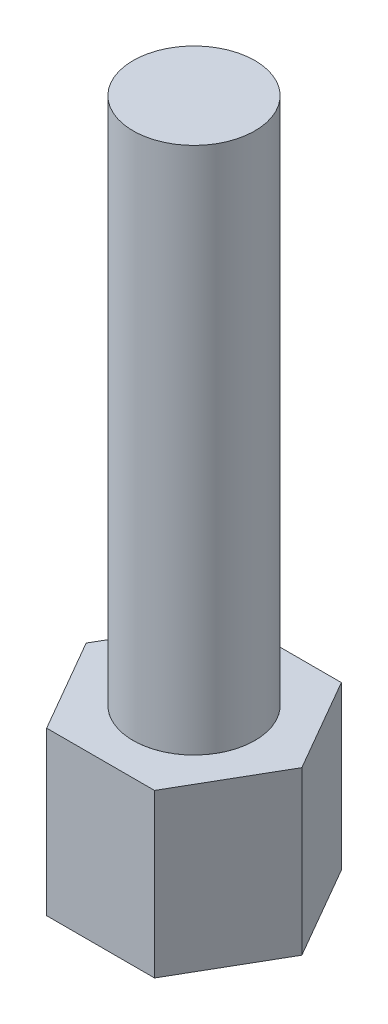
from build123d import *

# Parameters (mm, degrees)
EXTRUDE_1_DEPTH     = 4
SKETCH_3_R          = 1.5
EXTRUDE_2_DEPTH     = 13
SKETCH_4_R          = 1.5
CUT_EXTRUDE_1_DEPTH = 4


with BuildPart() as part:
    # 草图1 → 凸台-拉伸1 (new body)
    with BuildSketch(Plane(origin=(0, 0, 0), x_dir=(1, 0, 0), z_dir=(0, 1, 0))):
        Polygon((-1.327905619, 2.3), (-2.655811238, 0), (-1.327905619, -2.3), (1.327905619, -2.3), (2.655811238, 0), (1.327905619, 2.3), align=None)
    extrude(amount=EXTRUDE_1_DEPTH)

    # 草图3 → 凸台-拉伸2 (add)
    with BuildSketch(Plane(origin=(0, 4, 0), x_dir=(1, 0, 0), z_dir=(0, 1, 0))):
        with Locations(Location((0, 0, 0), (0, 0, 90))):
            Circle(SKETCH_3_R)
    extrude(amount=EXTRUDE_2_DEPTH)

    # 草图4 → 切除-拉伸1 (cut)
    with BuildSketch(Plane.XZ):
        with Locations(Location((0, 0, 0), (0, 0, 270))):
            Circle(SKETCH_4_R)
    extrude(amount=-CUT_EXTRUDE_1_DEPTH, mode=Mode.SUBTRACT)


with BuildPart() as cut_extrude_1_piece_1:
    # of the separate pieces the step leaves, piece 1, a body of its own (cut_extrude_1_pieces)
    add(part.part.solids().sort_by_distance((0, 17, -1.5))[0])


with BuildPart() as cut_extrude_1_piece_2:
    # of the separate pieces the step leaves, piece 2, a body of its own (cut_extrude_1_pieces)
    add(part.part.solids().sort_by_distance((-1.327905619, 0, -2.3))[0])


solid = Compound([cut_extrude_1_piece_1.part, cut_extrude_1_piece_2.part])
